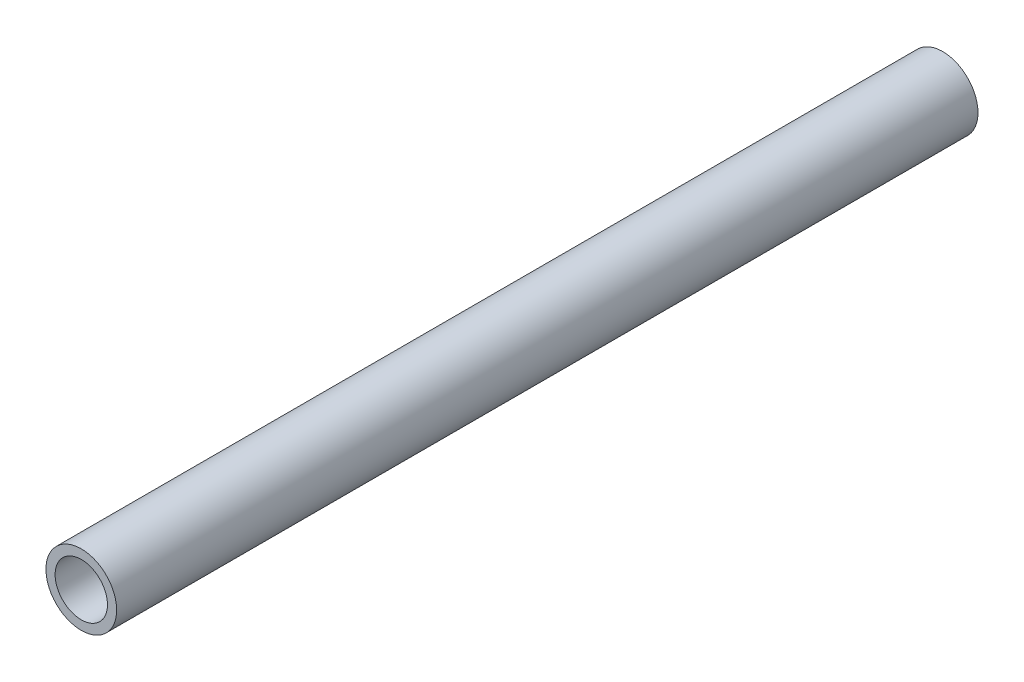
from build123d import *

# Parameters (mm, degrees)
SKETCH1_R           = 10.668
SKETCH1_R_2         = 7.8994
EXTRUDE_THIN1_DEPTH = 130


with BuildPart() as part:
    # Sketch1 → Extrude-Thin1 (new, symmetric)
    with BuildSketch(Plane.XY):
        Circle(SKETCH1_R)
        Circle(SKETCH1_R_2, mode=Mode.SUBTRACT)
    extrude(amount=EXTRUDE_THIN1_DEPTH, both=True)


solid = part.part
